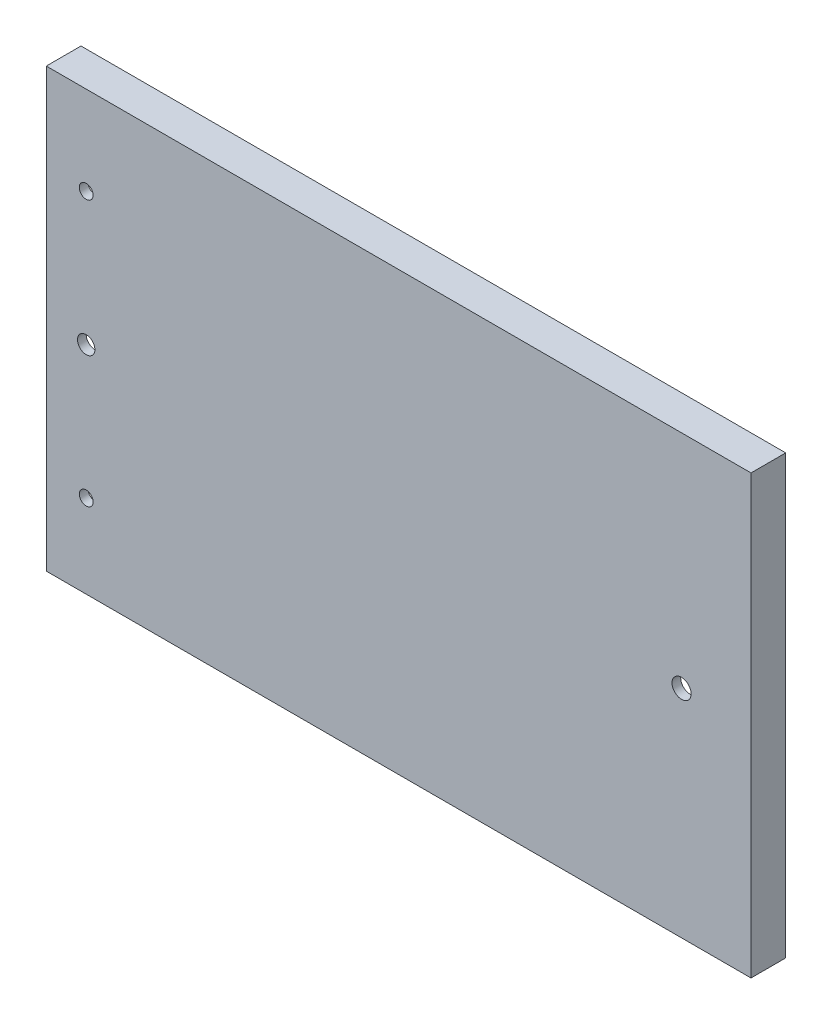
from build123d import *

# Parameters (mm, degrees)
SKETCH_1_W              = 406
SKETCH_1_H              = 252
EXTRUDE_1_DEPTH         = 20
SKETCH_2_W              = 385
SKETCH_2_H              = 233
CUT_EXTRUDE_1_DEPTH     = 15
HOLE_WIZARD_10_0_10_1_D = 10
HOLE_WIZARD_8_0_8_1_D   = 8
HOLE_WIZARD_11_0_11_1_D = 11


with BuildPart() as part:
    # Эскиз1 → Бобышка-Вытянуть1 (new body)
    with BuildSketch(Plane(origin=(0, 0, 0), x_dir=(-1, 0, 0), z_dir=(0, 0, -1))):
        with Locations((-203, 126)):
            Rectangle(SKETCH_1_W, SKETCH_1_H)
    extrude(amount=-EXTRUDE_1_DEPTH)

    # Эскиз2 → Вырез-Вытянуть1 (cut)
    with BuildSketch(Plane(origin=(0, 0, 0), x_dir=(-1, 0, 0), z_dir=(0, 0, -1))):
        with Locations((-195.5, 124.5)):
            Rectangle(SKETCH_2_W, SKETCH_2_H)
    extrude(amount=-CUT_EXTRUDE_1_DEPTH, mode=Mode.SUBTRACT)

    # Диаметр отверстия Ø10.0 (10)1 (through all)
    with Locations(Plane(origin=(0, 0, 15), x_dir=(-1, 0, 0), z_dir=(0, 0, -1))):
        with Locations((-23, 124.5)):
            Hole(HOLE_WIZARD_10_0_10_1_D / 2)

    # Диаметр отверстия Ø8.0 (8)1 (through all)
    with Locations(Plane(origin=(0, 0, 15), x_dir=(-1, 0, 0), z_dir=(0, 0, -1))):
        with Locations((-23, 201), (-23, 48)):
            Hole(HOLE_WIZARD_8_0_8_1_D / 2)

    # Диаметр отверстия Ø11.0 (11)1 (through all)
    with Locations(Plane(origin=(0, 0, 15), x_dir=(-1, 0, 0), z_dir=(0, 0, -1))):
        with Locations((-366, 124.5)):
            Hole(HOLE_WIZARD_11_0_11_1_D / 2)


solid = part.part
